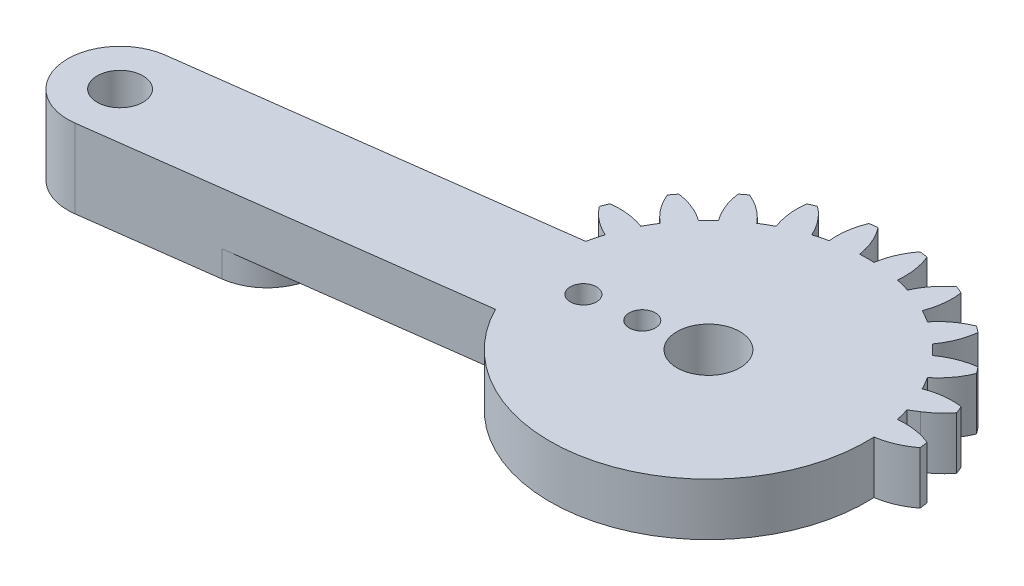
from build123d import *

# Parameters (mm, degrees)
SKETCH1_R           = 1.5
BOSS_EXTRUDE1_DEPTH = 4
SKETCH3_R           = 1.75
BOSS_EXTRUDE2_DEPTH = 4
CUT_EXTRUDE1_START  = -4
CUT_EXTRUDE1_DEPTH  = 4
CUT_EXTRUDE2_REACH  = 57.838
SKETCH5_R           = 2.4
SKETCH5_R_2         = 1
SKETCH8_R           = 1.75
BOSS_EXTRUDE3_DEPTH = 2


with BuildPart() as part:
    # Sketch1 → Boss-Extrude1 (new body)
    with BuildSketch(Plane(origin=(0, 0, 0), x_dir=(1, 0, 0), z_dir=(0, 1, 0))):
        with BuildLine():
            Line((20.000000458, 4), (2.081641936, 4))
            ThreePointArc((2.081641936, 4), (2.861028333, 4.588201733), (3.521749436, 5.30713988))
            ThreePointArc((3.521749436, 5.30713988), (3.405395609, 5.596745198), (3.282888305, 5.883801663))
            ThreePointArc((3.282888305, 5.883801663), (1.93527598, 5.894040025), (0.627094961, 5.57027124))
            ThreePointArc((0.627094961, 5.57027124), (0.366286148, 6.046375), (0.084372603, 6.510293938))
            ThreePointArc((0.084372603, 6.510293938), (1.018855105, 7.48132754), (1.683794586, 8.65351323))
            ThreePointArc((1.683794586, 8.65351323), (1.496450048, 8.903135899), (1.303821399, 9.148703928))
            ThreePointArc((1.303821399, 9.148703928), (-0.000522033, 8.809805691), (-1.180330337, 8.158486898))
            ThreePointArc((-1.180330337, 8.158486898), (-1.555477026, 8.550865528), (-1.947855656, 8.926012217))
            ThreePointArc((-1.947855656, 8.926012217), (-1.296536862, 10.105820521), (-0.957638625, 11.410163953))
            ThreePointArc((-0.957638625, 11.410163953), (-1.203206655, 11.602792602), (-1.452829324, 11.79013714))
            ThreePointArc((-1.452829324, 11.79013714), (-2.625015014, 11.125197659), (-3.596048616, 10.190715157))
            ThreePointArc((-3.596048616, 10.190715157), (-4.059967554, 10.472628702), (-4.536071314, 10.733437515))
            ThreePointArc((-4.536071314, 10.733437515), (-4.212302529, 12.041618533), (-4.222540891, 13.389230859))
            ThreePointArc((-4.222540891, 13.389230859), (-4.509597355, 13.511738163), (-4.799202674, 13.62809199))
            ThreePointArc((-4.799202674, 13.62809199), (-5.759348103, 12.682425791), (-6.455432668, 11.528463019))
            ThreePointArc((-6.455432668, 11.528463019), (-6.976508546, 11.680699536), (-7.503891752, 11.809396783))
            ThreePointArc((-7.503891752, 11.809396783), (-7.529737283, 13.156800143), (-7.888414517, 14.455843809))
            ThreePointArc((-7.888414517, 14.455843809), (-8.197396993, 14.499881098), (-8.507248835, 14.537314892))
            ThreePointArc((-8.507248835, 14.537314892), (-9.18992168, 13.375367565), (-9.563620196, 12.080565177))
            ThreePointArc((-9.563620196, 12.080565177), (-10.106342554, 12.09275), (-10.649064912, 12.080565177))
            ThreePointArc((-10.649064912, 12.080565177), (-11.022763428, 13.375367565), (-11.705436272, 14.537314892))
            ThreePointArc((-11.705436272, 14.537314892), (-12.015288115, 14.499881098), (-12.324270591, 14.455843809))
            ThreePointArc((-12.324270591, 14.455843809), (-12.682947825, 13.156800143), (-12.708793355, 11.809396783))
            ThreePointArc((-12.708793355, 11.809396783), (-13.236176561, 11.680699536), (-13.757252439, 11.528463019))
            ThreePointArc((-13.757252439, 11.528463019), (-14.453337005, 12.682425791), (-15.413482434, 13.62809199))
            ThreePointArc((-15.413482434, 13.62809199), (-15.703087752, 13.511738163), (-15.990144217, 13.389230859))
            ThreePointArc((-15.990144217, 13.389230859), (-16.000382579, 12.041618533), (-15.676613793, 10.733437515))
            ThreePointArc((-15.676613793, 10.733437515), (-16.152717554, 10.472628702), (-16.616636492, 10.190715157))
            ThreePointArc((-16.616636492, 10.190715157), (-17.587670094, 11.125197659), (-18.759855783, 11.79013714))
            ThreePointArc((-18.759855783, 11.79013714), (-19.009478453, 11.602792602), (-19.255046482, 11.410163953))
            ThreePointArc((-19.255046482, 11.410163953), (-18.916148245, 10.105820521), (-18.264829452, 8.926012217))
            ThreePointArc((-18.264829452, 8.926012217), (-18.657208082, 8.550865528), (-19.032354771, 8.158486898))
            ThreePointArc((-19.032354771, 8.158486898), (-20.212163074, 8.809805691), (-21.516506507, 9.148703928))
            ThreePointArc((-21.516506507, 9.148703928), (-21.709135156, 8.903135899), (-21.896479694, 8.65351323))
            ThreePointArc((-21.896479694, 8.65351323), (-21.231540213, 7.48132754), (-20.297057711, 6.510293938))
            ThreePointArc((-20.297057711, 6.510293938), (-20.578971255, 6.046375), (-20.839780068, 5.57027124))
            ThreePointArc((-20.839780068, 5.57027124), (-22.147961087, 5.894040025), (-23.495573413, 5.883801663))
            ThreePointArc((-23.495573413, 5.883801663), (-23.618080717, 5.596745198), (-23.734434544, 5.30713988))
            ThreePointArc((-23.734434544, 5.30713988), (-22.788768345, 4.346994451), (-21.634805572, 3.650909885))
            ThreePointArc((-21.634805572, 3.650909885), (-21.78704209, 3.129834008), (-21.915739337, 2.602450802))
            ThreePointArc((-21.915739337, 2.602450802), (-23.263142697, 2.576605271), (-24.562186363, 2.217928037))
            ThreePointArc((-24.562186363, 2.217928037), (-24.606223651, 1.908945561), (-24.643657446, 1.599093719))
            ThreePointArc((-24.643657446, 1.599093719), (-23.481710119, 0.916420874), (-22.186907731, 0.542722358))
            ThreePointArc((-22.186907731, 0.542722358), (-22.199092554, 0), (-22.186907731, -0.542722358))
            ThreePointArc((-22.186907731, -0.542722358), (-23.481710119, -0.916420874), (-24.643657446, -1.599093719))
            ThreePointArc((-24.643657446, -1.599093719), (-24.606223651, -1.908945561), (-24.562186363, -2.217928037))
            ThreePointArc((-24.562186363, -2.217928037), (-23.263142697, -2.576605271), (-21.915739337, -2.602450802))
            ThreePointArc((-21.915739337, -2.602450802), (-21.78704209, -3.129834008), (-21.634805572, -3.650909885))
            ThreePointArc((-21.634805572, -3.650909885), (-22.788768345, -4.346994451), (-23.734434544, -5.30713988))
            ThreePointArc((-23.734434544, -5.30713988), (-23.618080717, -5.596745198), (-23.495573413, -5.883801663))
            ThreePointArc((-23.495573413, -5.883801663), (-22.147961087, -5.894040025), (-20.839780068, -5.57027124))
            ThreePointArc((-20.839780068, -5.57027124), (-20.578971255, -6.046375), (-20.297057711, -6.510293938))
            ThreePointArc((-20.297057711, -6.510293938), (-21.231540213, -7.48132754), (-21.896479694, -8.65351323))
            ThreePointArc((-21.896479694, -8.65351323), (-21.709135156, -8.903135899), (-21.516506507, -9.148703928))
            ThreePointArc((-21.516506507, -9.148703928), (-20.212163074, -8.809805691), (-19.032354771, -8.158486898))
            ThreePointArc((-19.032354771, -8.158486898), (-18.657208082, -8.550865528), (-18.264829452, -8.926012217))
            ThreePointArc((-18.264829452, -8.926012217), (-18.916148245, -10.105820521), (-19.255046482, -11.410163953))
            ThreePointArc((-19.255046482, -11.410163953), (-19.009478453, -11.602792602), (-18.759855783, -11.79013714))
            ThreePointArc((-18.759855783, -11.79013714), (-17.587670094, -11.125197659), (-16.616636492, -10.190715157))
            ThreePointArc((-16.616636492, -10.190715157), (-16.152717554, -10.472628702), (-15.676613793, -10.733437515))
            ThreePointArc((-15.676613793, -10.733437515), (-16.000382579, -12.041618533), (-15.990144217, -13.389230859))
            ThreePointArc((-15.990144217, -13.389230859), (-15.703087752, -13.511738163), (-15.413482434, -13.62809199))
            ThreePointArc((-15.413482434, -13.62809199), (-14.453337005, -12.682425791), (-13.757252439, -11.528463019))
            ThreePointArc((-13.757252439, -11.528463019), (-13.236176561, -11.680699536), (-12.708793355, -11.809396783))
            ThreePointArc((-12.708793355, -11.809396783), (-12.682947825, -13.156800143), (-12.324270591, -14.455843809))
            ThreePointArc((-12.324270591, -14.455843809), (-12.015288115, -14.499881098), (-11.705436272, -14.537314892))
            ThreePointArc((-11.705436272, -14.537314892), (-11.022763428, -13.375367565), (-10.649064912, -12.080565177))
            ThreePointArc((-10.649064912, -12.080565177), (-10.106342554, -12.09275), (-9.563620196, -12.080565177))
            ThreePointArc((-9.563620196, -12.080565177), (-9.18992168, -13.375367565), (-8.507248835, -14.537314892))
            ThreePointArc((-8.507248835, -14.537314892), (-8.197396993, -14.499881098), (-7.888414517, -14.455843809))
            ThreePointArc((-7.888414517, -14.455843809), (-7.529737283, -13.156800143), (-7.503891752, -11.809396783))
            ThreePointArc((-7.503891752, -11.809396783), (-6.976508546, -11.680699536), (-6.455432668, -11.528463019))
            ThreePointArc((-6.455432668, -11.528463019), (-5.759348103, -12.682425791), (-4.799202674, -13.62809199))
            ThreePointArc((-4.799202674, -13.62809199), (-4.509597355, -13.511738163), (-4.222540891, -13.389230859))
            ThreePointArc((-4.222540891, -13.389230859), (-4.212302529, -12.041618533), (-4.536071314, -10.733437515))
            ThreePointArc((-4.536071314, -10.733437515), (-4.059967554, -10.472628702), (-3.596048616, -10.190715157))
            ThreePointArc((-3.596048616, -10.190715157), (-2.625015014, -11.125197659), (-1.452829324, -11.79013714))
            ThreePointArc((-1.452829324, -11.79013714), (-1.203206655, -11.602792602), (-0.957638625, -11.410163953))
            ThreePointArc((-0.957638625, -11.410163953), (-1.296536862, -10.105820521), (-1.947855656, -8.926012217))
            ThreePointArc((-1.947855656, -8.926012217), (-1.555477026, -8.550865528), (-1.180330337, -8.158486898))
            ThreePointArc((-1.180330337, -8.158486898), (-0.000522033, -8.809805691), (1.303821399, -9.148703928))
            ThreePointArc((1.303821399, -9.148703928), (1.496450048, -8.903135899), (1.683794586, -8.65351323))
            ThreePointArc((1.683794586, -8.65351323), (1.018855105, -7.48132754), (0.084372603, -6.510293938))
            ThreePointArc((0.084372603, -6.510293938), (0.366286148, -6.046375), (0.627094961, -5.57027124))
            ThreePointArc((0.627094961, -5.57027124), (1.93527598, -5.894040025), (3.282888305, -5.883801663))
            ThreePointArc((3.282888305, -5.883801663), (3.405395609, -5.596745198), (3.521749436, -5.30713988))
            ThreePointArc((3.521749436, -5.30713988), (2.861028333, -4.588201733), (2.081641936, -4))
            Line((2.081641936, -4), (20.000000458, -4))
            ThreePointArc((20.000000458, -4), (24, 0), (20.000000458, 4))
        make_face()
        with Locations(Location((-10.106342554, 0, 0), (0, 0, 270))):
            Circle(SKETCH1_R, mode=Mode.SUBTRACT)
        with Locations(Location((20, 0, 0), (0, 0, 270))):
            Circle(SKETCH1_R, mode=Mode.SUBTRACT)
    extrude(amount=BOSS_EXTRUDE1_DEPTH)

    # Sketch3 → Boss-Extrude2 (add)
    with BuildSketch(Plane(origin=(0, 4, 0), x_dir=(1, 0, 0), z_dir=(0, 1, 0))):
        with BuildLine():
            ThreePointArc((-9.584237785, -3.965779445), (-14.072121999, -0.522104769), (-10.628447323, 3.965779445))
            Line((-10.628447323, 3.965779445), (-50.286241778, -1.255268243))
            ThreePointArc((-50.286241778, -1.255268243), (-53.729916454, -5.743152458), (-49.24203224, -9.186827134))
            Line((-49.24203224, -9.186827134), (-9.584237785, -3.965779445))
        make_face()
        with Locations(Location((-49.764137009, -5.221047689, 0), (0, 0, 270))):
            Circle(SKETCH3_R, mode=Mode.SUBTRACT)
    extrude(amount=-BOSS_EXTRUDE2_DEPTH)

    # Sketch4 → Cut-Extrude1 (cut)
    with BuildSketch(Plane(origin=(0, 4, 0), x_dir=(1, 0, 0), z_dir=(0, 1, 0)).offset(CUT_EXTRUDE1_START)):
        with BuildLine():
            ThreePointArc((20.000000458, -4), (24, 0), (20.000000458, 4))
            Line((20.000000458, 4), (2.081641936, 4))
            Line((2.081641936, 4), (1.43808022, 3.600125745))
            ThreePointArc((1.43808022, 3.600125745), (1.581217534, 3.104116905), (1.70305423, 2.602450802))
            ThreePointArc((1.70305423, 2.602450802), (3.050457589, 2.576605271), (4.349501255, 2.217928037))
            ThreePointArc((4.349501255, 2.217928037), (4.393538544, 1.908945561), (4.430972339, 1.599093719))
            ThreePointArc((4.430972339, 1.599093719), (3.269025011, 0.916420874), (1.974222624, 0.542722358))
            ThreePointArc((1.974222624, 0.542722358), (1.70305423, -2.602450802), (0.627094961, -5.57027124))
            ThreePointArc((0.627094961, -5.57027124), (1.93527598, -5.894040025), (3.282888305, -5.883801663))
            ThreePointArc((3.282888305, -5.883801663), (3.405395609, -5.596745198), (3.521749436, -5.30713988))
            ThreePointArc((3.521749436, -5.30713988), (2.861028333, -4.588201733), (2.081641936, -4))
            Line((2.081641936, -4), (20.000000458, -4))
        make_face()
        with BuildLine():
            ThreePointArc((1.683794586, -8.65351323), (1.018855105, -7.48132754), (0.084372603, -6.510293938))
            ThreePointArc((0.084372603, -6.510293938), (-0.512518948, -7.361599771), (-1.180330337, -8.158486898))
            ThreePointArc((-1.180330337, -8.158486898), (-0.000522033, -8.809805691), (1.303821399, -9.148703928))
            ThreePointArc((1.303821399, -9.148703928), (1.496450048, -8.903135899), (1.683794586, -8.65351323))
        make_face()
        with BuildLine():
            ThreePointArc((-0.957638625, -11.410163953), (-1.296536862, -10.105820521), (-1.947855656, -8.926012217))
            ThreePointArc((-1.947855656, -8.926012217), (-2.744742783, -9.593823606), (-3.596048616, -10.190715157))
            ThreePointArc((-3.596048616, -10.190715157), (-2.625015014, -11.125197659), (-1.452829324, -11.79013714))
            ThreePointArc((-1.452829324, -11.79013714), (-1.203206655, -11.602792602), (-0.957638625, -11.410163953))
        make_face()
        with BuildLine():
            ThreePointArc((-4.222540891, -13.389230859), (-4.212302529, -12.041618533), (-4.536071314, -10.733437515))
            ThreePointArc((-4.536071314, -10.733437515), (-5.478647477, -11.172244217), (-6.455432668, -11.528463019))
            ThreePointArc((-6.455432668, -11.528463019), (-5.759348103, -12.682425791), (-4.799202674, -13.62809199))
            ThreePointArc((-4.799202674, -13.62809199), (-4.509597355, -13.511738163), (-4.222540891, -13.389230859))
        make_face()
        with BuildLine():
            ThreePointArc((-7.888414517, -14.455843809), (-7.529737283, -13.156800143), (-7.503891752, -11.809396783))
            ThreePointArc((-7.503891752, -11.809396783), (-8.527921943, -11.989294847), (-9.563620196, -12.080565177))
            ThreePointArc((-9.563620196, -12.080565177), (-9.18992168, -13.375367565), (-8.507248835, -14.537314892))
            ThreePointArc((-8.507248835, -14.537314892), (-8.197396993, -14.499881098), (-7.888414517, -14.455843809))
        make_face()
        with BuildLine():
            ThreePointArc((-11.705436272, -14.537314892), (-11.022763428, -13.375367565), (-10.649064912, -12.080565177))
            ThreePointArc((-10.649064912, -12.080565177), (-11.684763165, -11.989294847), (-12.708793355, -11.809396783))
            ThreePointArc((-12.708793355, -11.809396783), (-12.682947825, -13.156800143), (-12.324270591, -14.455843809))
            ThreePointArc((-12.324270591, -14.455843809), (-12.015288115, -14.499881098), (-11.705436272, -14.537314892))
        make_face()
        with BuildLine():
            ThreePointArc((-15.413482434, -13.62809199), (-14.453337005, -12.682425791), (-13.757252439, -11.528463019))
            ThreePointArc((-13.757252439, -11.528463019), (-14.734037631, -11.172244217), (-15.676613793, -10.733437515))
            ThreePointArc((-15.676613793, -10.733437515), (-16.000382579, -12.041618533), (-15.990144217, -13.389230859))
            ThreePointArc((-15.990144217, -13.389230859), (-15.703087752, -13.511738163), (-15.413482434, -13.62809199))
        make_face()
        with BuildLine():
            ThreePointArc((-18.759855783, -11.79013714), (-17.587670094, -11.125197659), (-16.616636492, -10.190715157))
            ThreePointArc((-16.616636492, -10.190715157), (-17.467942324, -9.593823606), (-18.264829452, -8.926012217))
            ThreePointArc((-18.264829452, -8.926012217), (-18.916148245, -10.105820521), (-19.255046482, -11.410163953))
            ThreePointArc((-19.255046482, -11.410163953), (-19.009478453, -11.602792602), (-18.759855783, -11.79013714))
        make_face()
        with BuildLine():
            ThreePointArc((-21.516506507, -9.148703928), (-20.212163074, -8.809805691), (-19.032354771, -8.158486898))
            ThreePointArc((-19.032354771, -8.158486898), (-19.70016616, -7.361599771), (-20.297057711, -6.510293938))
            ThreePointArc((-20.297057711, -6.510293938), (-21.231540213, -7.48132754), (-21.896479694, -8.65351323))
            ThreePointArc((-21.896479694, -8.65351323), (-21.709135156, -8.903135899), (-21.516506507, -9.148703928))
        make_face()
        with BuildLine():
            ThreePointArc((-21.942853375, 2.47620963), (-21.92946485, 2.539366405), (-21.915739337, 2.602450802))
            ThreePointArc((-21.915739337, 2.602450802), (-23.263142697, 2.576605271), (-24.562186363, 2.217928037))
            ThreePointArc((-24.562186363, 2.217928037), (-24.56889027, 2.173784387), (-24.575459377, 2.129620475))
            Line((-24.575459377, 2.129620475), (-21.942853375, 2.47620963))
        make_face()
        with BuildLine():
            ThreePointArc((-23.495573413, -5.883801663), (-22.147961087, -5.894040025), (-20.839780068, -5.57027124))
            ThreePointArc((-20.839780068, -5.57027124), (-20.869365339, -5.512888815), (-20.898643838, -5.455349261))
            Line((-20.898643838, -5.455349261), (-23.531249839, -5.801938416))
            ThreePointArc((-23.531249839, -5.801938416), (-23.513474108, -5.842897269), (-23.495573413, -5.883801663))
        make_face()
    extrude(amount=CUT_EXTRUDE1_DEPTH, mode=Mode.SUBTRACT)

    # Sketch5 → Cut-Extrude2 (cut, up to next)
    with BuildSketch(Plane(origin=(0, 4, 0), x_dir=(1, 0, 0), z_dir=(0, 1, 0)), mode=Mode.PRIVATE) as cut_extrude2_sk1:
        with Locations(Location((-10.106342554, 0, 0), (0, 0, 270))):
            Circle(SKETCH5_R)
    cut_extrude2_tool1 = extrude(cut_extrude2_sk1.sketch, amount=-CUT_EXTRUDE2_REACH, mode=Mode.PRIVATE) & part.part
    # Sketch5 → Cut-Extrude2 (cut, up to next)
    with BuildSketch(Plane(origin=(0, 4, 0), x_dir=(1, 0, 0), z_dir=(0, 1, 0)), mode=Mode.PRIVATE) as cut_extrude2_sk2:
        with Locations(Location((-14.56784443, -0.587367865, 0), (0, 0, 270))):
            Circle(SKETCH5_R_2)
    cut_extrude2_tool2 = extrude(cut_extrude2_sk2.sketch, amount=-CUT_EXTRUDE2_REACH, mode=Mode.PRIVATE) & part.part
    # Sketch5 → Cut-Extrude2 (cut, up to next)
    with BuildSketch(Plane(origin=(0, 4, 0), x_dir=(1, 0, 0), z_dir=(0, 1, 0)), mode=Mode.PRIVATE) as cut_extrude2_sk3:
        with Locations(Location((-18.533623876, -1.109472634, 0), (0, 0, 270))):
            Circle(SKETCH5_R_2)
    cut_extrude2_tool3 = extrude(cut_extrude2_sk3.sketch, amount=-CUT_EXTRUDE2_REACH, mode=Mode.PRIVATE) & part.part
    add(cut_extrude2_tool1.solids().sort_by_distance((-10.106343, 4, 0))[0], mode=Mode.SUBTRACT)
    add(cut_extrude2_tool2.solids().sort_by_distance((-14.567844, 4, 0.587368))[0], mode=Mode.SUBTRACT)
    add(cut_extrude2_tool3.solids().sort_by_distance((-18.533624, 4, 1.109473))[0], mode=Mode.SUBTRACT)

    # Sketch8 → Boss-Extrude3 (add)
    with BuildSketch(Plane.XZ):
        with BuildLine():
            Line((-39.327583626, 7.881565212), (-49.24203224, 9.186827134))
            ThreePointArc((-49.24203224, 9.186827134), (-53.729916454, 5.743152458), (-50.286241778, 1.255268243))
            Line((-50.286241778, 1.255268243), (-40.371793164, -0.049993679))
            ThreePointArc((-40.371793164, -0.049993679), (-35.88390895, 3.393680998), (-39.327583626, 7.881565212))
        make_face()
        with Locations(Location((-49.764137009, 5.221047689, 0), (0, 0, 90))):
            Circle(SKETCH8_R, mode=Mode.SUBTRACT)
    extrude(amount=BOSS_EXTRUDE3_DEPTH)


solid = part.part
